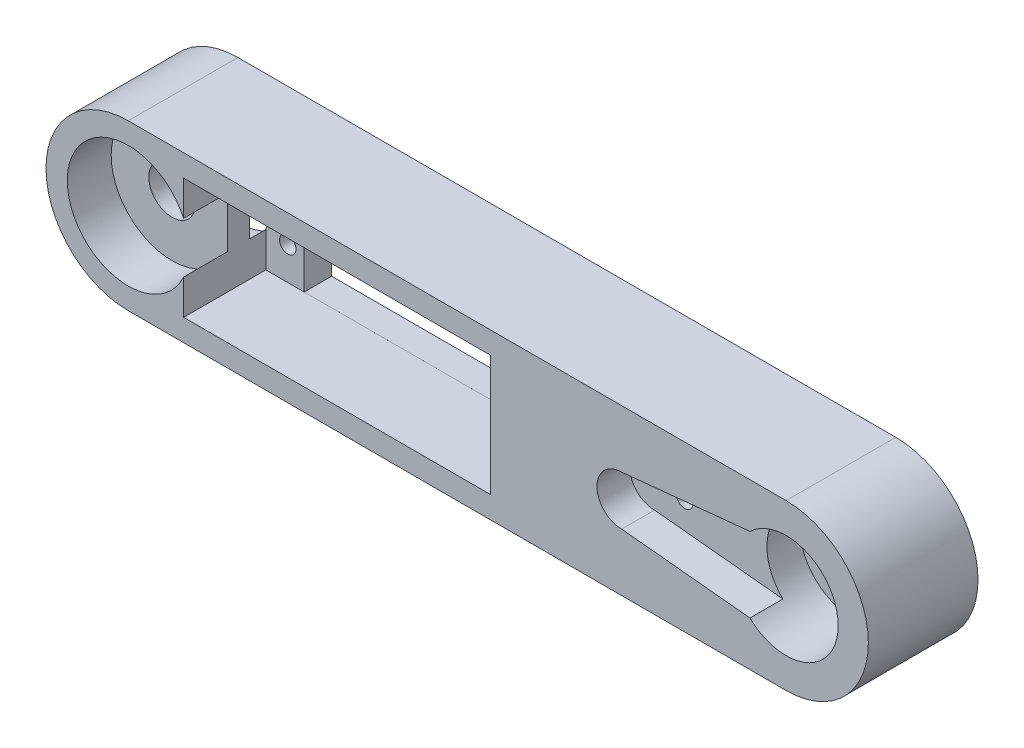
from build123d import *

# Parameters (mm, degrees)
BOSS_EXTRUDE1_DEPTH = 10
CUT_EXTRUDE4_DEPTH  = 6
SKETCH3_3_R         = 7.5
SKETCH3_3_R_2       = 4.25
SKETCH3_3_R_3       = 1.5
CUT_EXTRUDE5_DEPTH  = 12
SKETCH3_4_R         = 4.25
CUT_EXTRUDE6_DEPTH  = 138.295302177
SKETCH4_R           = 4.25
SKETCH4_W           = 42
SKETCH4_H           = 22
CUT_EXTRUDE8_DEPTH  = 138.295302177
SKETCH5_R           = 11.11
CUT_EXTRUDE10_DEPTH = 8
SKETCH7_W           = 56
SKETCH7_H           = 22.002715538
CUT_EXTRUDE12_DEPTH = 15
SKETCH8_R           = 1.5
CUT_EXTRUDE13_DEPTH = 14
CUT_EXTRUDE14_REACH = 139.295
SKETCH9_R           = 9.5


with BuildPart() as part:
    # Sketch1 → Boss-Extrude1 (new, symmetric)
    with BuildSketch(Plane.XY):
        with BuildLine():
            Line((120, 15), (0, 15))
            ThreePointArc((0, 15), (-15, 0), (0, -15))
            Line((0, -15), (120, -15))
            ThreePointArc((120, -15), (135, 0), (120, 15))
        make_face()
    extrude(amount=BOSS_EXTRUDE1_DEPTH, both=True)

    # Sketch3 → Cut-Extrude4 (cut)
    with BuildSketch(Plane.XY.offset(10)):
        with BuildLine():
            ThreePointArc((90, 4.5), (86.818019485, 3.181980515), (85.5, 0))
            Line((85.5, 0), (94, 0))
            ThreePointArc((94, 0), (94.099918834, 0.538305422), (94.386363636, 1.004895044))
            ThreePointArc((94.386363636, 1.004895044), (92.80427997, 3.519376912), (90, 4.5))
        make_face()
        with BuildLine():
            Line((94, 0), (85.5, 0))
            ThreePointArc((85.5, 0), (86.818019485, -3.181980515), (90, -4.5))
            ThreePointArc((90, -4.5), (92.80427997, -3.519376912), (94.386363636, -1.004895044))
            ThreePointArc((94.386363636, -1.004895044), (94.099918834, -0.538305422), (94, 0))
        make_face()
        with BuildLine():
            Line((118.514851485, 7.351485149), (90, 4.5))
            ThreePointArc((90, 4.5), (92.80427997, 3.519376912), (94.386363636, 1.004895044))
            ThreePointArc((94.386363636, 1.004895044), (96.038305422, 1.400081166), (97, 0))
            ThreePointArc((97, 0), (96.038305422, -1.400081166), (94.386363636, -1.004895044))
            ThreePointArc((94.386363636, -1.004895044), (92.80427997, -3.519376912), (90, -4.5))
            Line((90, -4.5), (118.514851485, -7.351485149))
            ThreePointArc((118.514851485, -7.351485149), (112.5, 0), (118.514851485, 7.351485149))
        make_face()
    extrude(amount=-CUT_EXTRUDE4_DEPTH, mode=Mode.SUBTRACT)

    # Sketch3<3> → Cut-Extrude5 (cut)
    # profile 1 of 2: a face of its own
    with BuildSketch(Plane.XY.offset(10)):
        with Locations((120, 0)):
            Circle(SKETCH3_3_R)
        with Locations((120, 0)):
            Circle(SKETCH3_3_R_2, mode=Mode.SUBTRACT)
    # profile 2 of 2: a face of its own
    with BuildSketch(Plane.XY.offset(10)):
        with Locations((95.5, 0)):
            Circle(SKETCH3_3_R_3)
    extrude(amount=-CUT_EXTRUDE5_DEPTH, mode=Mode.SUBTRACT)

    # Sketch3<4> → Cut-Extrude6 (cut, through all)
    with BuildSketch(Plane.XY.offset(10)):
        with Locations((120, 0)):
            Circle(SKETCH3_4_R)
    extrude(amount=-CUT_EXTRUDE6_DEPTH, mode=Mode.SUBTRACT)

    # Sketch4 → Cut-Extrude8 (cut, through all)
    with BuildSketch(Plane.XY.offset(10)):
        Circle(SKETCH4_R)
        with Locations((38.1, 0)):
            Rectangle(SKETCH4_W, SKETCH4_H)
    extrude(amount=-CUT_EXTRUDE8_DEPTH, mode=Mode.SUBTRACT)

    # Sketch5 → Cut-Extrude10 (cut)
    with BuildSketch(Plane(origin=(0, 0, -10), x_dir=(-1, 0, 0), z_dir=(0, 0, -1))):
        Circle(SKETCH5_R)
    cut_extrude10 = extrude(amount=-CUT_EXTRUDE10_DEPTH, mode=Mode.SUBTRACT)

    # Mirror2: Cut-Extrude10 across plane
    add(cut_extrude10.mirror(Plane.XY), mode=Mode.SUBTRACT)

    # Sketch7 → Cut-Extrude12 (cut)
    with BuildSketch(Plane.XY.offset(10)):
        with Locations((38.1, 0)):
            Rectangle(SKETCH7_W, SKETCH7_H)
    extrude(amount=-CUT_EXTRUDE12_DEPTH, mode=Mode.SUBTRACT)

    # Sketch8 → Cut-Extrude13 (cut)
    with BuildSketch(Plane.XY.offset(-5)):
        with Locations((14.1, 5)):
            Circle(SKETCH8_R)
        with Locations((14.1, -5)):
            Circle(SKETCH8_R)
        with Locations((62.1, -5)):
            Circle(SKETCH8_R)
        with Locations((62.1, 5)):
            Circle(SKETCH8_R)
    extrude(amount=-CUT_EXTRUDE13_DEPTH, mode=Mode.SUBTRACT)

    # Cut-Extrude14: up to this face of the body (flat: up to its plane)
    cut_extrude14_end = Plane(part.part.faces().sort_by_distance((112.712132034, 0, -2))[0])
    # Sketch9 → Cut-Extrude14 (cut, up to the picked face)
    with BuildSketch(Plane.XY.offset(10), mode=Mode.PRIVATE) as cut_extrude14_sk1:
        with Locations((120, 0)):
            Circle(SKETCH9_R)
    cut_extrude14_tool1 = split(extrude(cut_extrude14_sk1.sketch, amount=-CUT_EXTRUDE14_REACH, mode=Mode.PRIVATE), bisect_by=cut_extrude14_end, keep=Keep.BOTH, mode=Mode.PRIVATE)
    add(cut_extrude14_tool1.solids().sort_by(Axis((120, 0, 10), (0, 0, -1)))[0], mode=Mode.SUBTRACT)


solid = part.part
